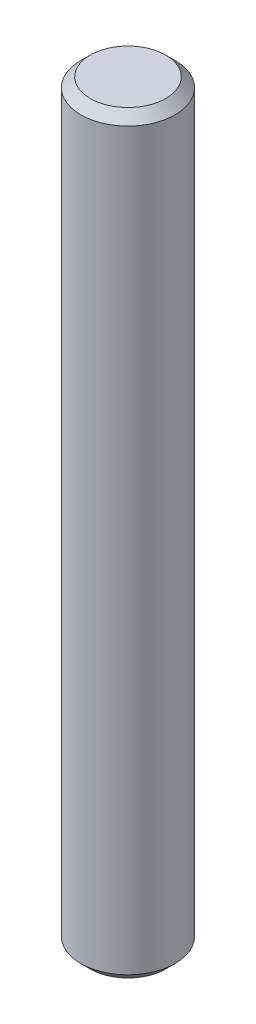
from build123d import *

# Parameters (mm, degrees)
SKETCH1_R           = 2.5
BOSS_EXTRUDE1_DEPTH = 40
CHAMFER1_SIZE       = 0.5


with BuildPart() as part:
    # Sketch1 → Boss-Extrude1 (new body)
    with BuildSketch(Plane(origin=(0, 0, 0), x_dir=(1, 0, 0), z_dir=(0, 1, 0))):
        with Locations(Location((0, 0, 0), (0, 0, 270))):
            Circle(SKETCH1_R)
    extrude(amount=BOSS_EXTRUDE1_DEPTH)

    # Chamfer1
    chamfer1_edges = [part.edges().sort_by_distance(p)[0] for p in [
        (0, 0, -2.5),
        (0, 40, -2.5),
    ]]
    chamfer(chamfer1_edges, length=CHAMFER1_SIZE)


solid = part.part
